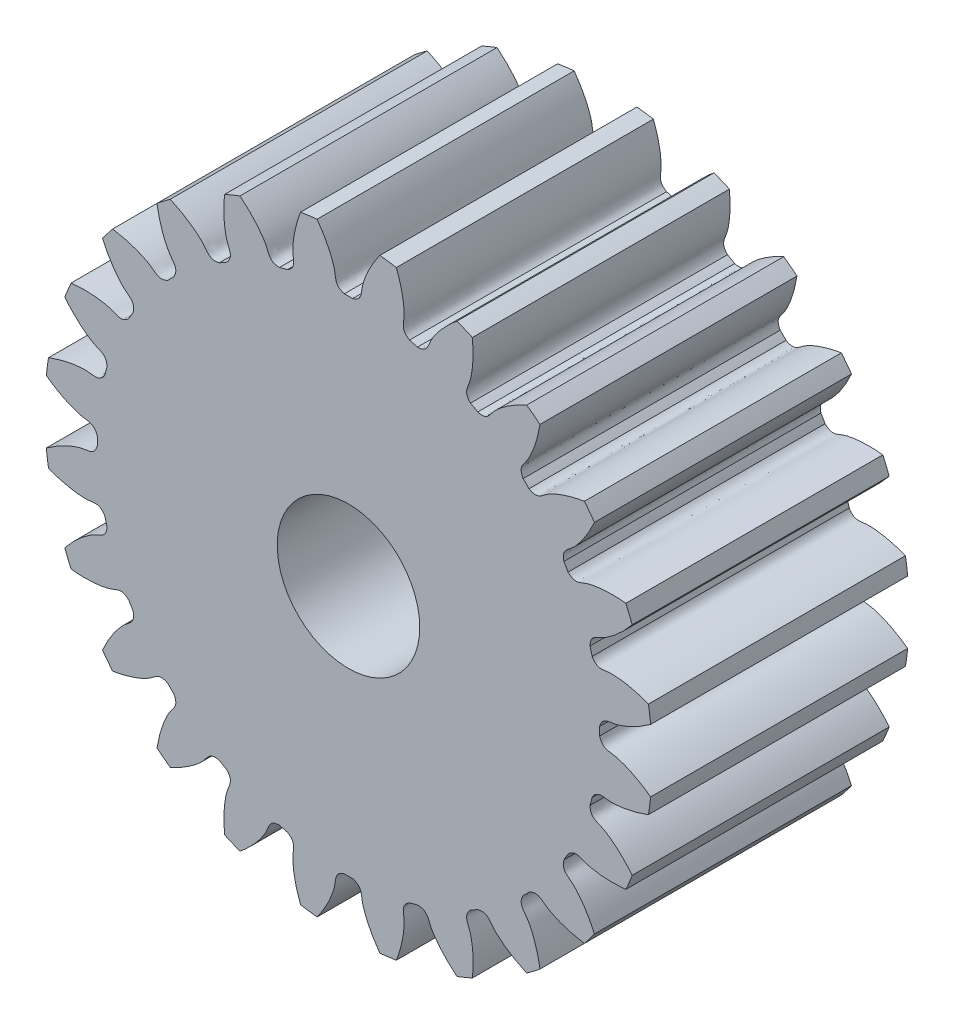
from build123d import *

# Parameters (mm, degrees)
SKETCH_1_R               = 6.5
EXTRUDE_1_DEPTH          = 5.5
CUT_EXTRUDE_1_DEPTH      = 11.712142643
PATTERN_CIRCULAR_1_COUNT = 24
CUT_EXTRUDE_2_REACH      = 12.67
SKETCH_4_R               = 1.525


with BuildPart() as part:
    # 草图1 → 凸台-拉伸1 (new body)
    with BuildSketch(Plane.XY):
        Circle(SKETCH_1_R)
    extrude(amount=EXTRUDE_1_DEPTH)

    # 草图2 → 切除-拉伸1 (cut, through all)
    with BuildSketch(Plane.XY):
        with BuildLine():
            ThreePointArc((0.088415956, 5.374272753), (0, 5.375), (-0.088415956, 5.374272753))
            add(Edge.make_bspline(
                [(-0.088415956, 5.374272753), (-0.283956108, 5.428430036), (-0.269523883, 5.557861799), (-0.293138588, 5.686342226), (-0.296517959, 5.702916521), (-0.300724242, 5.721620073), (-0.305840304, 5.742426358), (-0.311952817, 5.765305336), (-0.319146149, 5.790224685), (-0.327504211, 5.817149434), (-0.337109789, 5.846042111), (-0.348044663, 5.876862729), (-0.360389484, 5.909568827), (-0.374223721, 5.944115495), (-0.389625595, 5.980455405), (-0.406672011, 6.018538843), (-0.425438499, 6.058313744), (-0.445999145, 6.099725726), (-0.468426535, 6.142718129), (-0.492791687, 6.187232054), (-0.519163995, 6.233206399), (-0.547611171, 6.280577906), (-0.57819918, 6.329281201), (-0.610992189, 6.379248841), (-0.64605251, 6.430411359), (-0.68344054, 6.482697309), (-0.723214712, 6.53603332), (-0.765431443, 6.590344144), (-0.810145078, 6.645552705), (-0.857407842, 6.701580158), (-0.907269792, 6.758345935), (-0.959778768, 6.81576781), (-1.014980347, 6.873761948), (-1.0729178, 6.932242967), (-1.133632047, 6.991123994), (-1.197161611, 7.05031673), (-1.263542589, 7.109731505), (-1.332808587, 7.169277345), (-1.430211047, 7.249680778), (-1.505961903, 7.308439159), (-1.55780976, 7.347058965)],
                knots=[0, 0, 0, 0, 0.143961355, 0.149818462, 0.156576662, 0.164235955, 0.172796342, 0.182257821, 0.192620395, 0.203884061, 0.216048821, 0.229114674, 0.24308162, 0.25794966, 0.273718793, 0.290389019, 0.307960339, 0.326432751, 0.345806258, 0.366080857, 0.38725655, 0.409333336, 0.432311215, 0.456190188, 0.480970254, 0.506651413, 0.533233666, 0.560717012, 0.589101451, 0.618386984, 0.64857361, 0.679661329, 0.711650141, 0.744540047, 0.778331046, 0.813023138, 0.848616324, 0.885110603, 0.922505975, 1, 1, 1, 1], degree=3))
            ThreePointArc((-1.55780976, 7.347058965), (0, 7.510395907), (1.55780976, 7.347058965))
            add(Edge.make_bspline(
                [(0.088415956, 5.374272753), (0.283956108, 5.428430036), (0.269523883, 5.557861799), (0.293138588, 5.686342226), (0.296517959, 5.702916521), (0.300724242, 5.721620073), (0.305840304, 5.742426358), (0.311952817, 5.765305336), (0.319146149, 5.790224685), (0.327504211, 5.817149434), (0.337109789, 5.846042111), (0.348044663, 5.876862729), (0.360389484, 5.909568827), (0.374223721, 5.944115495), (0.389625595, 5.980455405), (0.406672011, 6.018538843), (0.425438499, 6.058313744), (0.445999145, 6.099725726), (0.468426535, 6.142718129), (0.492791687, 6.187232054), (0.519163995, 6.233206399), (0.547611171, 6.280577906), (0.57819918, 6.329281201), (0.610992189, 6.379248841), (0.64605251, 6.430411359), (0.68344054, 6.482697309), (0.723214712, 6.53603332), (0.765431443, 6.590344144), (0.810145078, 6.645552705), (0.857407842, 6.701580158), (0.907269792, 6.758345935), (0.959778768, 6.81576781), (1.014980347, 6.873761948), (1.0729178, 6.932242967), (1.133632047, 6.991123994), (1.197161611, 7.05031673), (1.263542589, 7.109731505), (1.332808587, 7.169277345), (1.430211047, 7.249680778), (1.505961903, 7.308439159), (1.55780976, 7.347058965)],
                knots=[0, 0, 0, 0, 0.143961355, 0.149818462, 0.156576662, 0.164235955, 0.172796342, 0.182257821, 0.192620395, 0.203884061, 0.216048821, 0.229114674, 0.24308162, 0.25794966, 0.273718793, 0.290389019, 0.307960339, 0.326432751, 0.345806258, 0.366080857, 0.38725655, 0.409333336, 0.432311215, 0.456190188, 0.480970254, 0.506651413, 0.533233666, 0.560717012, 0.589101451, 0.618386984, 0.64857361, 0.679661329, 0.711650141, 0.744540047, 0.778331046, 0.813023138, 0.848616324, 0.885110603, 0.922505975, 1, 1, 1, 1], degree=3))
        make_face()
    cut_extrude_1 = extrude(amount=CUT_EXTRUDE_1_DEPTH, mode=Mode.SUBTRACT)

    # 阵列(圆周)1: 切除-拉伸1 ×24 about axis
    pattern_circular_1_axis = Axis((0, 0, 5.5), (0, 0, -1))
    for i in range(1, PATTERN_CIRCULAR_1_COUNT):
        add(cut_extrude_1.rotate(pattern_circular_1_axis, i * 360 / PATTERN_CIRCULAR_1_COUNT), mode=Mode.SUBTRACT)

    # 草图4 → 切除-拉伸2 (cut, up to next)
    with BuildSketch(Plane.XY.offset(5.5), mode=Mode.PRIVATE) as cut_extrude_2_sk1:
        Circle(SKETCH_4_R)
    cut_extrude_2_tool1 = extrude(cut_extrude_2_sk1.sketch, amount=-CUT_EXTRUDE_2_REACH, mode=Mode.PRIVATE) & part.part
    add(cut_extrude_2_tool1.solids().sort_by_distance((0, 0, 5.5))[0], mode=Mode.SUBTRACT)


solid = part.part
